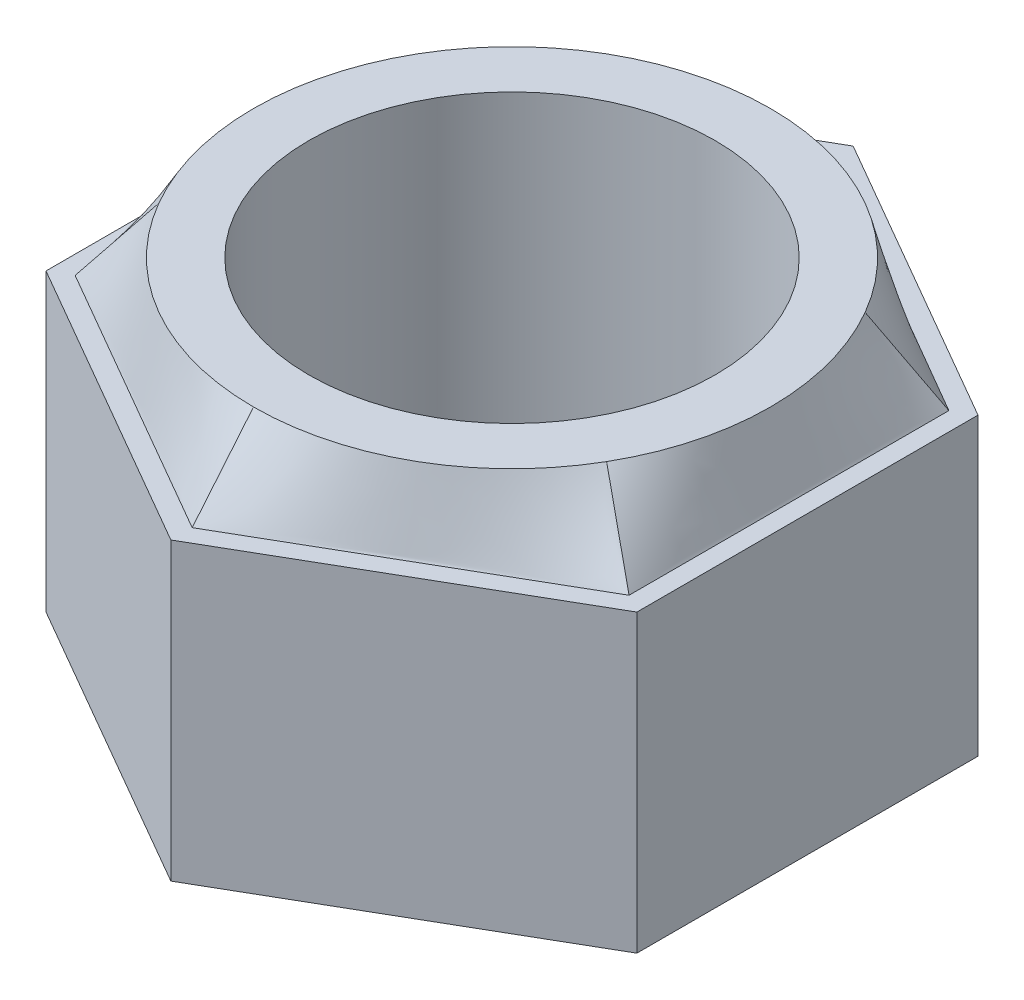
from build123d import *

# Parameters (mm, degrees)
BODY_DEPTH           = 4
M5_CLEARANCE_HOLE2_D = 5.5


with BuildPart() as part:
    # Sketch1 → Body (new body)
    with BuildSketch(Plane(origin=(0, 0, 0), x_dir=(1, 0, 0), z_dir=(0, 1, 0))):
        Polygon((0, 4.618802154), (-4, 2.309401077), (-4, -2.309401077), (0, -4.618802154), (4, -2.309401077), (4, 2.309401077), align=None)
    extrude(amount=BODY_DEPTH)

    # Sketch5 → Loft1 section 0
    with BuildSketch(Plane(origin=(0, 4, 0), x_dir=(1, 0, 0), z_dir=(0, 1, 0))):
        with BuildLine():
            Line((3.75, 2.165063509), (0, 4.330127019))
            Line((0, 4.330127019), (-3.75, 2.165063509))
            Line((-3.75, 2.165063509), (-3.75, -2.165063509))
            Line((-3.75, -2.165063509), (0, -4.330127019))
            Line((0, -4.330127019), (3.75, -2.165063509))
            Line((3.75, -2.165063509), (3.75, 2.165063509))
        make_face()
    # Sketch4 for Loft1 → Loft1 section 1
    with BuildSketch(Plane(origin=(0, 5, 0), x_dir=(1, 0, 0), z_dir=(0, 1, 0))):
        with BuildLine():
            # circular arc as an exact rational Bezier (weights 1, cos(half-angle), 1)
            Bezier((3.031088913, 1.75), (2.020725942, 3.5), (0, 3.5), weights=[1, 0.866025404, 1])
            Bezier((0, 3.5), (-2.020725942, 3.5), (-3.031088913, 1.75), weights=[1, 0.866025404, 1])
            Bezier((-3.031088913, 1.75), (-4.041451885, 0), (-3.031088913, -1.75), weights=[1, 0.866025404, 1])
            Bezier((-3.031088913, -1.75), (-2.020725942, -3.5), (0, -3.5), weights=[1, 0.866025404, 1])
            Bezier((0, -3.5), (2.020725942, -3.5), (3.031088913, -1.75), weights=[1, 0.866025404, 1])
            Bezier((3.031088913, -1.75), (4.041451885, 0), (3.031088913, 1.75), weights=[1, 0.866025404, 1])
        make_face()
    loft()

    # M5 Clearance Hole2 (through all)
    with Locations(Plane(origin=(0, 5, 0), x_dir=(1, 0, 0), z_dir=(0, 1, 0))):
        with Locations((0, 0)):
            Hole(M5_CLEARANCE_HOLE2_D / 2)


solid = part.part
